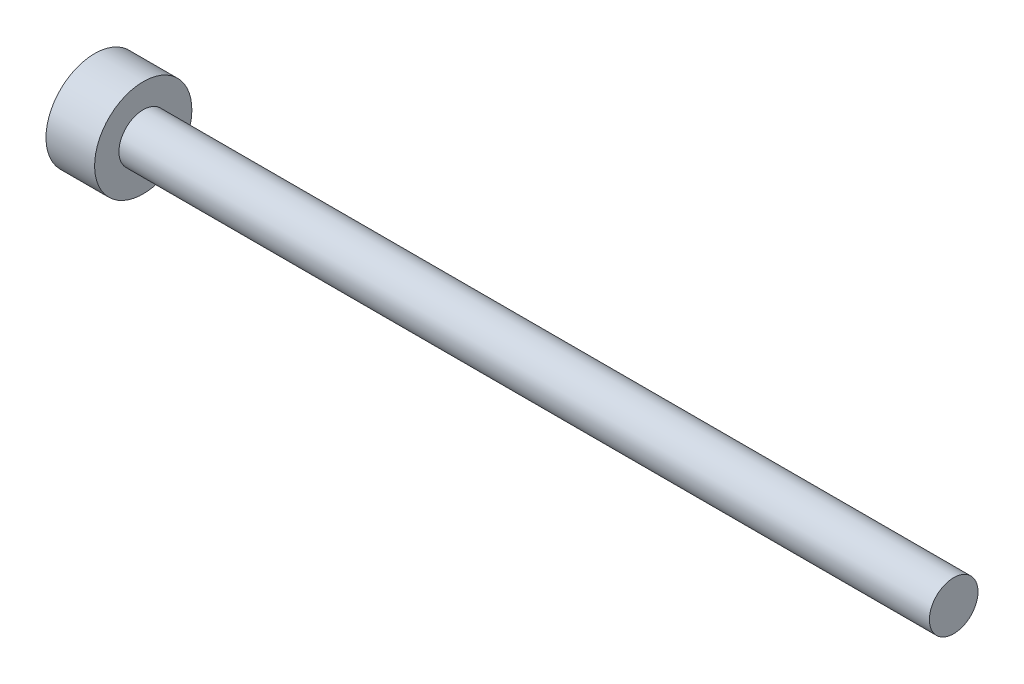
from build123d import *

# Parameters (mm, degrees)
SKETCH1_W = 50
SKETCH1_H = 1.5


with BuildPart() as part:
    # Sketch1 → Revolve1 (revolve)
    with BuildSketch(Plane.XY):
        Polygon((-53, 0), (-50, 0), (-50, 1.5), (-50, 3), (-53, 3), align=None)
        with Locations((-25, 0.75)):
            Rectangle(SKETCH1_W, SKETCH1_H)
    revolve(axis=Axis((0, 0, 0), (-1, 0, 0)))


solid = part.part
